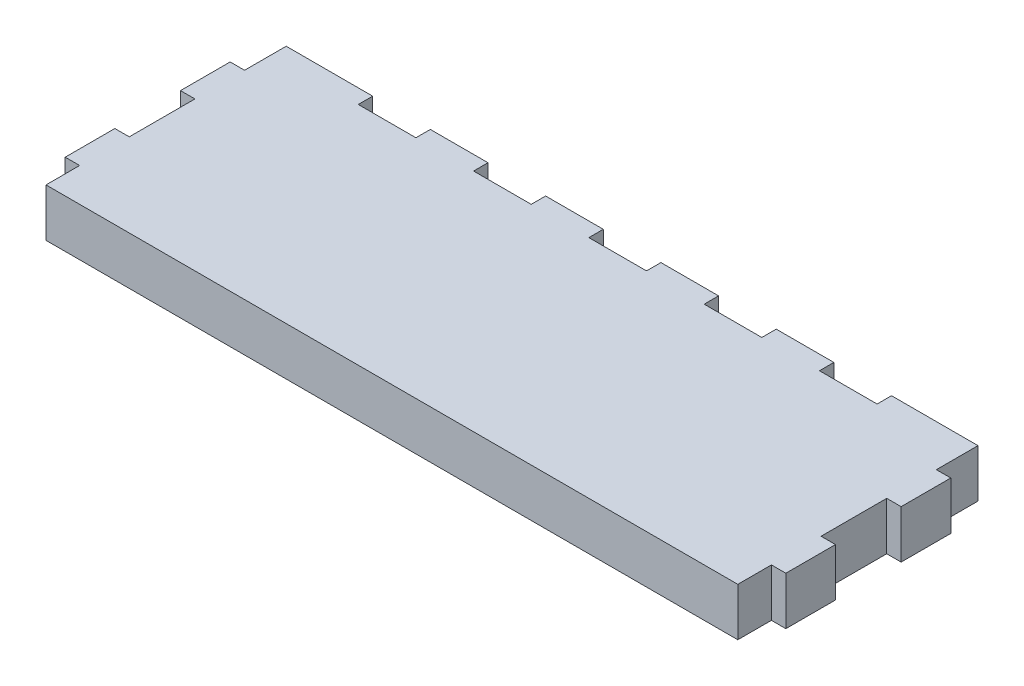
from build123d import *

# Parameters (mm, degrees)
BOSS_EXTRUDE1_DEPTH = 10


with BuildPart() as part:
    # Sketch1 → Boss-Extrude1 (new body)
    with BuildSketch(Plane(origin=(0, 0, 0), x_dir=(1, 0, 0), z_dir=(0, 1, 0))):
        Polygon((-32.812912017, 69.703683257), (-20.812911913, 69.703683257), (-20.812911913, 72.703689337), (-8.812911808, 72.703689337), (-8.812911808, 69.703683257), (3.187088063, 69.703683257), (3.187088063, 72.703689337), (15.1870884, 72.703689337), (15.1870884, 69.703683257), (27.187088504, 69.703683257), (27.187088504, 72.703689337), (39.187088609, 72.703689337), (39.187088609, 69.703683257), (51.18708685, 69.703683257), (51.18708685, 72.703689337), (69.187089801, 72.703689337), (69.187089801, 69.703683257), (69.187089801, 64.03671205), (72.18708843, 64.03671205), (72.18708843, 53.703688085), (69.187089801, 53.703688085), (69.187089801, 40.036708117), (72.18708843, 40.036708117), (72.18708843, 29.703684151), (69.187089801, 29.703684151), (69.187089801, 22.703684866), (-74.812911451, 22.703684866), (-74.812911451, 29.703684151), (-77.81291008, 29.703684151), (-77.81291008, 40.036708117), (-74.812911451, 40.036708117), (-74.812911451, 53.703688085), (-77.81291008, 53.703688085), (-77.81291008, 64.03671205), (-74.812911451, 64.03671205), (-74.812911451, 69.703683257), (-74.812911451, 72.703689337), (-56.812912226, 72.703689337), (-56.812912226, 69.703683257), (-44.812910259, 69.703683257), (-44.812910259, 72.703689337), (-32.812912017, 72.703689337), align=None)
    extrude(amount=BOSS_EXTRUDE1_DEPTH)


solid = part.part
